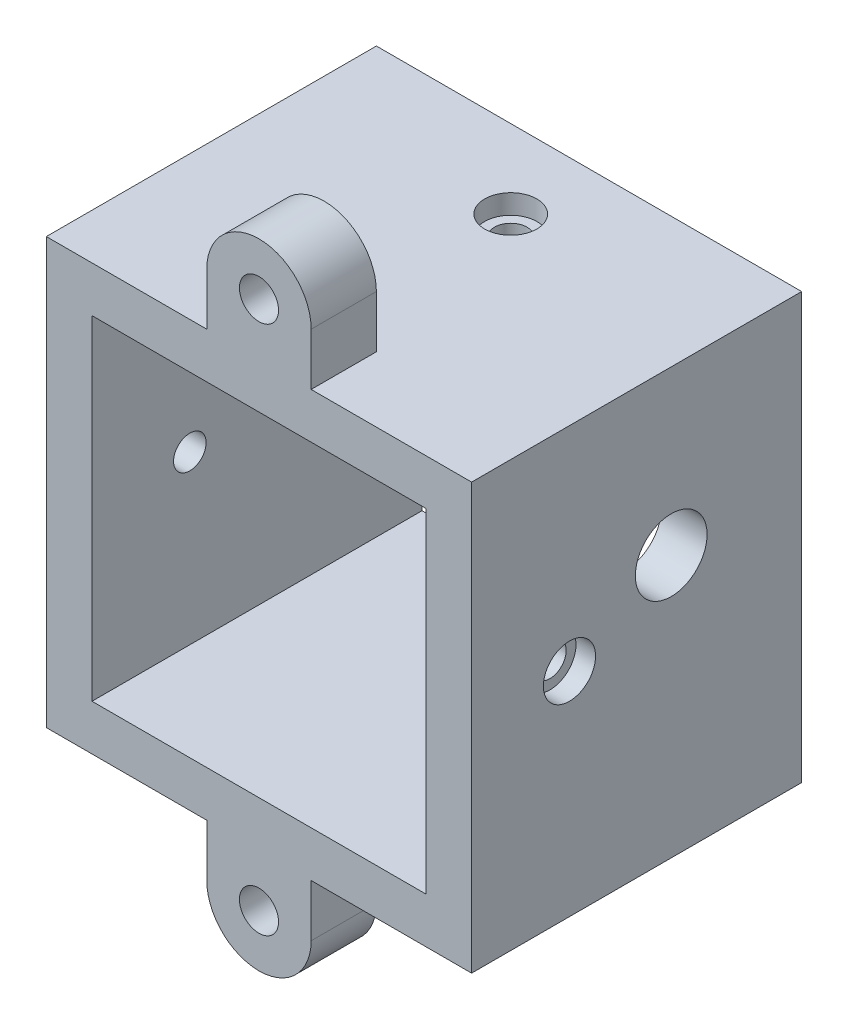
from build123d import *

# Parameters (mm, degrees)
ESBO_O1_W                = 51.2
ESBO_O1_H                = 51.2
RESSALTO_EXTRUS_O1_DEPTH = 50.6
ESBO_O1_3_R              = 3
RESSALTO_EXTRUS_O2_DEPTH = 10
ESBO_O3_R                = 5.5
CORTE_EXTRUS_O2_DEPTH    = 7
ESBO_O4_R                = 2.5
CORTE_EXTRUS_O3_DEPTH    = 96.77765919
ESBO_O5_R                = 4
CORTE_EXTRUS_O4_DEPTH    = 3
ESBO_O6_R                = 2.5
CORTE_EXTRUS_O5_DEPTH    = 7
ESBO_O7_R                = 4
CORTE_EXTRUS_O6_DEPTH    = 3


with BuildPart() as part:
    # Esboço1 → Ressalto-extrusão1 (new body)
    with BuildSketch(Plane.XY):
        Polygon((-8, 32.6), (-32.6, 32.6), (-32.6, -32.6), (-8, -32.6), (8, -32.6), (32.6, -32.6), (32.6, 32.6), (8, 32.6), align=None)
        Rectangle(ESBO_O1_W, ESBO_O1_H, mode=Mode.SUBTRACT)
    extrude(amount=-RESSALTO_EXTRUS_O1_DEPTH)

    # Esboço1<3> → Ressalto-extrusão2 (add)
    # profile 1 of 2: a face of its own
    with BuildSketch(Plane.XY):
        with BuildLine():
            Line((8, 32.6), (8, 40.6))
            ThreePointArc((8, 40.6), (0, 48.6), (-8, 40.6))
            Line((-8, 40.6), (-8, 32.6))
            Line((-8, 32.6), (8, 32.6))
        make_face()
        with Locations((0, 40.6)):
            Circle(ESBO_O1_3_R, mode=Mode.SUBTRACT)
    # profile 2 of 2: a face of its own
    with BuildSketch(Plane.XY):
        with BuildLine():
            ThreePointArc((8, -40.6), (0, -48.6), (-8, -40.6))
            Line((-8, -40.6), (-8, -32.6))
            Line((-8, -32.6), (8, -32.6))
            Line((8, -32.6), (8, -40.6))
        make_face()
        with Locations((0, -40.6)):
            Circle(ESBO_O1_3_R, mode=Mode.SUBTRACT)
    extrude(amount=-RESSALTO_EXTRUS_O2_DEPTH)

    # Esboço3 → Corte-extrusão2 (cut)
    with BuildSketch(Plane(origin=(32.6, 0, 0), x_dir=(0, 0, -1), z_dir=(1, 0, 0))):
        with Locations((30.6, 7.6)):
            Circle(ESBO_O3_R)
    extrude(amount=-CORTE_EXTRUS_O2_DEPTH, mode=Mode.SUBTRACT)

    # Esboço4 → Corte-extrusão3 (cut, through all)
    with BuildSketch(Plane(origin=(32.6, 0, 0), x_dir=(0, 0, -1), z_dir=(1, 0, 0))):
        with Locations((15, 0)):
            Circle(ESBO_O4_R)
    extrude(amount=-CORTE_EXTRUS_O3_DEPTH, mode=Mode.SUBTRACT)

    # Esboço5 → Corte-extrusão4 (cut)
    with BuildSketch(Plane(origin=(32.6, 0, 0), x_dir=(0, 0, -1), z_dir=(1, 0, 0))):
        with Locations((15, 0)):
            Circle(ESBO_O5_R)
    corte_extrus_o4 = extrude(amount=-CORTE_EXTRUS_O4_DEPTH, mode=Mode.SUBTRACT)

    # Espelhar1: Corte-extrusão4 across plane
    add(corte_extrus_o4.mirror(Plane(origin=(0, 0, 0), x_dir=(0, 0, 1), z_dir=(1, 0, 0))), mode=Mode.SUBTRACT)

    # Esboço6 → Corte-extrusão5 (cut)
    with BuildSketch(Plane(origin=(0, 32.6, 0), x_dir=(1, 0, 0), z_dir=(0, 1, 0))):
        with Locations(Location((0, 38.6, 0), (0, 0, 270))):
            Circle(ESBO_O6_R)
    extrude(amount=-CORTE_EXTRUS_O5_DEPTH, mode=Mode.SUBTRACT)

    # Esboço7 → Corte-extrusão6 (cut)
    with BuildSketch(Plane(origin=(0, 32.6, 0), x_dir=(1, 0, 0), z_dir=(0, 1, 0))):
        with Locations(Location((0, 38.6, 0), (0, 0, 270))):
            Circle(ESBO_O7_R)
    extrude(amount=-CORTE_EXTRUS_O6_DEPTH, mode=Mode.SUBTRACT)


solid = part.part
